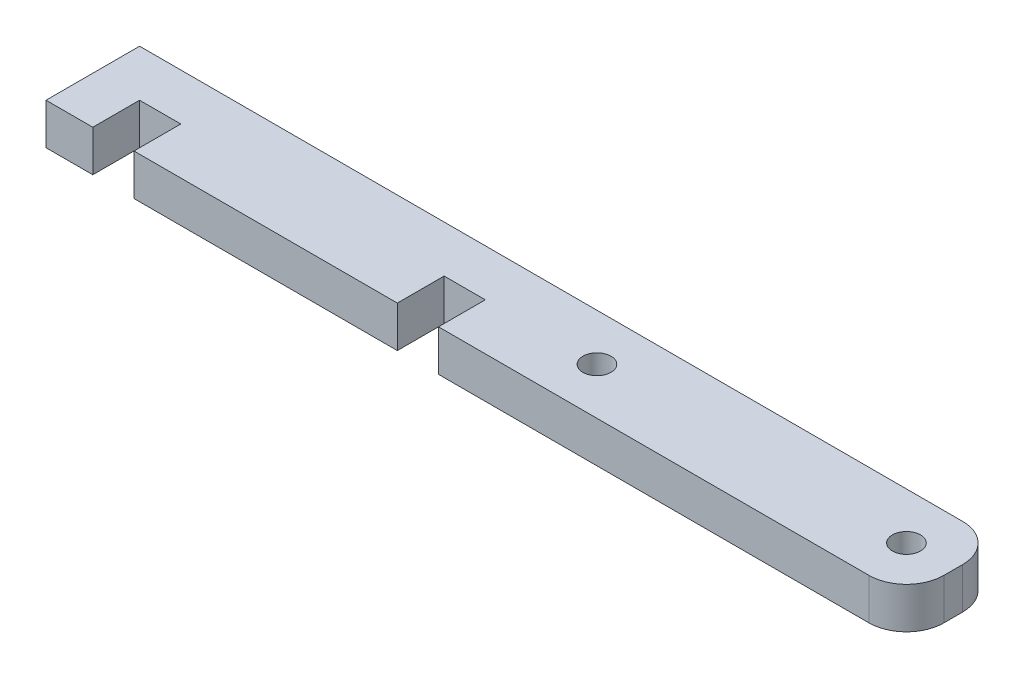
from build123d import *

# Parameters (mm, degrees)
BOSS_EXTRUDE1_DEPTH = 2.794
SKETCH2_R           = 0.9525
CUT_EXTRUDE1_DEPTH  = 59.792605897
FILLET2_R           = 2.54


with BuildPart() as part:
    # Sketch1 → Boss-Extrude1 (new body)
    with BuildSketch(Plane(origin=(0, 0, 0), x_dir=(1, 0, 0), z_dir=(0, 1, 0))):
        Polygon((0, 0), (3.175, 0), (3.175, 3.175), (5.969, 3.175), (5.969, 0), (23.837859958, 0), (23.837859958, 3.175), (26.631859958, 3.175), (26.631859958, 0), (58.381859958, 0), (58.381859958, 6.35), (0, 6.35), align=None)
    extrude(amount=BOSS_EXTRUDE1_DEPTH)

    # Sketch2 → Cut-Extrude1 (cut, through all)
    with BuildSketch(Plane(origin=(0, 2.794, 0), x_dir=(1, 0, 0), z_dir=(0, 1, 0))):
        with Locations(Location((55.206859958, 3.175, 0), (0, 0, 270))):
            Circle(SKETCH2_R)
        with Locations(Location((34.206859958, 3.175, 0), (0, 0, 270))):
            Circle(SKETCH2_R)
    extrude(amount=-CUT_EXTRUDE1_DEPTH, mode=Mode.SUBTRACT)

    # Fillet2
    fillet2_edges = [part.edges().sort_by_distance(p)[0] for p in [
        (58.381859958, 1.397, -6.35),
        (58.381859958, 1.397, 0),
    ]]
    fillet(fillet2_edges, radius=FILLET2_R)


solid = part.part
